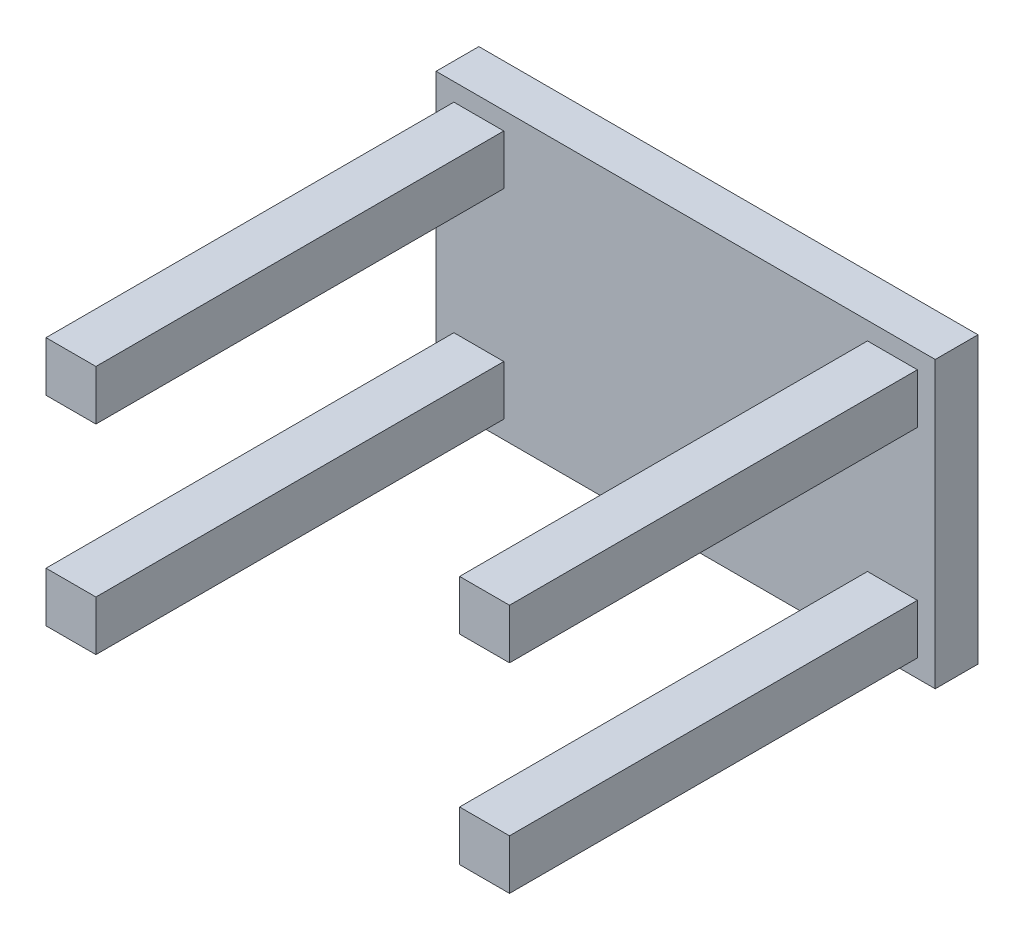
from build123d import *

# Parameters (mm, degrees)
SKETCH_1_W      = 350
SKETCH_1_H      = 200
EXTRUDE_1_DEPTH = 30
SKETCH_2_W      = 35
SKETCH_2_H      = 35
EXTRUDE_2_DEPTH = 286


with BuildPart() as part:
    # 草图1 → 凸台-拉伸1 (new body)
    with BuildSketch(Plane.XY):
        Rectangle(SKETCH_1_W, SKETCH_1_H)
    extrude(amount=EXTRUDE_1_DEPTH)

    # 草图2 → 凸台-拉伸2 (add)
    with BuildSketch(Plane.XY.offset(30)):
        with Locations((145, 70)):
            Rectangle(SKETCH_2_W, SKETCH_2_H)
        with Locations((145, -70)):
            Rectangle(SKETCH_2_W, SKETCH_2_H)
        with Locations((-145, -70)):
            Rectangle(SKETCH_2_W, SKETCH_2_H)
        with Locations((-145, 70)):
            Rectangle(SKETCH_2_W, SKETCH_2_H)
    extrude(amount=EXTRUDE_2_DEPTH)


solid = part.part
